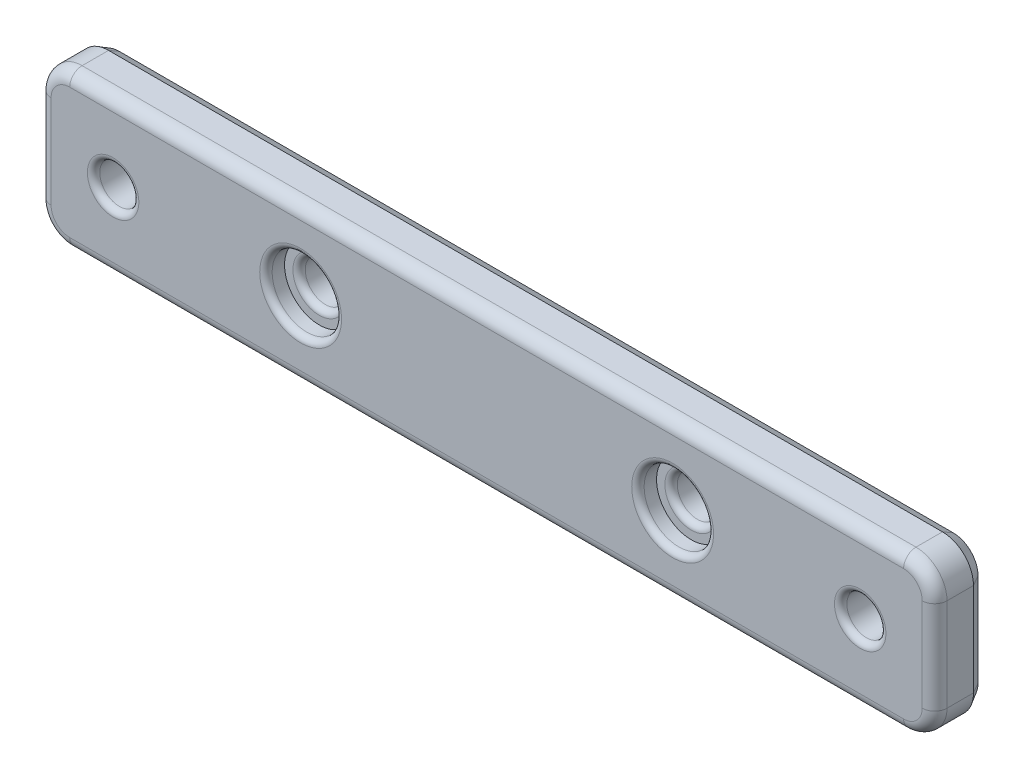
from build123d import *
from OCP.BRepFilletAPI import BRepFilletAPI_MakeChamfer

# Parameters (mm, degrees)
SKETCH2_W           = 144.5
SKETCH2_H           = 25
BOSS_EXTRUDE1_DEPTH = 8
SKETCH3_R           = 3.15
SKETCH3_R_2         = 3.25
CUT_EXTRUDE1_DEPTH  = 74.758474089
SKETCH4_R           = 5.6
CUT_EXTRUDE2_DEPTH  = 3
FILLET1_R           = 5
FILLET2_R           = 2
FILLET3_R           = 1
CHAMFER1_SIZE       = 1
CHAMFER1_SIZE2      = 1.732050808
CHAMFER2_SIZE       = 1
CHAMFER2_SIZE2      = 0.577350269


with BuildPart() as part:
    # Sketch2 → Boss-Extrude1 (new body)
    with BuildSketch(Plane.XY):
        Rectangle(SKETCH2_W, SKETCH2_H)
    extrude(amount=BOSS_EXTRUDE1_DEPTH)

    # Sketch3 → Cut-Extrude1 (cut, through all)
    with BuildSketch(Plane.XY.offset(8)):
        with Locations((-60.25, 0)):
            Circle(SKETCH3_R)
        with Locations((60.25, 0)):
            Circle(SKETCH3_R)
        with Locations((-30, 0)):
            Circle(SKETCH3_R_2)
        with Locations((30, 0)):
            Circle(SKETCH3_R_2)
    extrude(amount=-CUT_EXTRUDE1_DEPTH, mode=Mode.SUBTRACT)

    # Sketch4 → Cut-Extrude2 (cut)
    with BuildSketch(Plane.XY.offset(8)):
        with Locations((-30, 0)):
            Circle(SKETCH4_R)
        with Locations((30, 0)):
            Circle(SKETCH4_R)
    extrude(amount=-CUT_EXTRUDE2_DEPTH, mode=Mode.SUBTRACT)

    # Fillet1
    fillet1_edges = [part.edges().sort_by_distance(p)[0] for p in [
        (72.25, -12.5, 4),
        (-72.25, -12.5, 4),
        (-72.25, 12.5, 4),
        (72.25, 12.5, 4),
    ]]
    fillet(fillet1_edges, radius=FILLET1_R)

    # Fillet2
    fillet2_edges = [part.edges().sort_by_distance(p)[0] for p in [
        (0, -12.5, 8),
        (-72.25, 0, 8),
        (72.25, 0, 8),
        (0, 12.5, 8),
        (70.785533906, 11.035533906, 8),
        (70.785533906, -11.035533906, 8),
        (-70.785533906, 11.035533906, 8),
        (-70.785533906, -11.035533906, 8),
    ]]
    fillet(fillet2_edges, radius=FILLET2_R)

    # Fillet3
    fillet3_edges = [part.edges().sort_by_distance(p)[0] for p in [
        (-63.4, 0, 8),
        (57.1, 0, 8),
        (-35.6, 0, 8),
        (-33.25, 0, 5),
        (24.4, 0, 8),
        (26.75, 0, 5),
    ]]
    fillet(fillet3_edges, radius=FILLET3_R)

    # Chamfer1
    chamfer1_edges = [part.edges().sort_by_distance(p)[0] for p in [
        (0, -12.5, 0),
        (72.25, 0, 0),
        (-72.25, 0, 0),
        (0, 12.5, 0),
        (70.785533906, 11.035533906, 0),
        (70.785533906, -11.035533906, 0),
        (-70.785533906, 11.035533906, 0),
        (-70.785533906, -11.035533906, 0),
    ]]
    chamfer1_side = [part.faces().sort_by_distance(p)[0] for p in [
        (0, 0, 0),
    ]]
    chamfer(chamfer1_edges, length=CHAMFER1_SIZE, length2=CHAMFER1_SIZE2, reference=chamfer1_side[0])

    # Chamfer2: one chamfer whose edges measure the first distance from different faces: ONE call of the kernel's chamfer builder (chamfer() names one face for all edges)
    chamfer2_edges_1 = [part.edges().sort_by_distance(p)[0] for p in [
        (-63.4, 0, 0),
    ]]
    chamfer2_side_1 = [part.faces().sort_by_distance(p)[0] for p in [
        (-63.4, 0, 3.5),
    ]]
    chamfer2_edges_2 = [part.edges().sort_by_distance(p)[0] for p in [
        (26.75, 0, 0),
    ]]
    chamfer2_side_2 = [part.faces().sort_by_distance(p)[0] for p in [
        (26.75, 0, 2),
    ]]
    chamfer2_edges_3 = [part.edges().sort_by_distance(p)[0] for p in [
        (-33.25, 0, 0),
    ]]
    chamfer2_side_3 = [part.faces().sort_by_distance(p)[0] for p in [
        (-33.25, 0, 2),
    ]]
    chamfer2_edges_4 = [part.edges().sort_by_distance(p)[0] for p in [
        (57.1, 0, 0),
    ]]
    chamfer2_side_4 = [part.faces().sort_by_distance(p)[0] for p in [
        (57.1, 0, 3.5),
    ]]
    chamfer2 = BRepFilletAPI_MakeChamfer(part.part.solid().wrapped)
    for e in chamfer2_edges_1:
        chamfer2.Add(CHAMFER2_SIZE, CHAMFER2_SIZE2, e.wrapped, chamfer2_side_1[0].wrapped)  # the first distance lies on this face
    for e in chamfer2_edges_2:
        chamfer2.Add(CHAMFER2_SIZE, CHAMFER2_SIZE2, e.wrapped, chamfer2_side_2[0].wrapped)  # the first distance lies on this face
    for e in chamfer2_edges_3:
        chamfer2.Add(CHAMFER2_SIZE, CHAMFER2_SIZE2, e.wrapped, chamfer2_side_3[0].wrapped)  # the first distance lies on this face
    for e in chamfer2_edges_4:
        chamfer2.Add(CHAMFER2_SIZE, CHAMFER2_SIZE2, e.wrapped, chamfer2_side_4[0].wrapped)  # the first distance lies on this face
    add(Compound.cast(chamfer2.Shape()), mode=Mode.REPLACE)


solid = part.part
